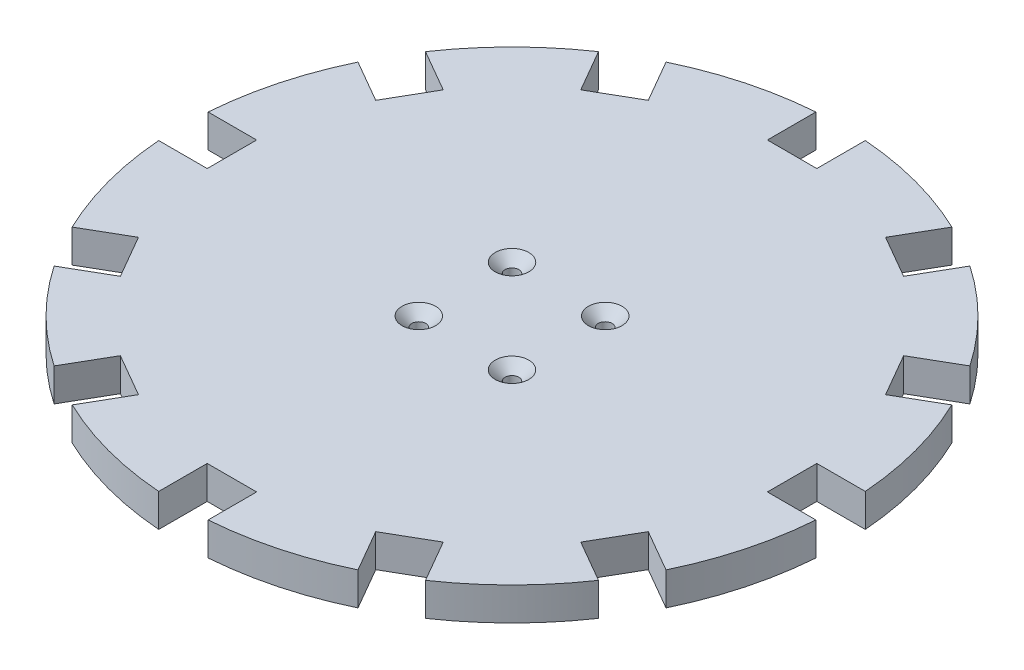
from build123d import *

# Parameters (mm, degrees)
SKIZZE1_R                       = 100
AUFSATZ_LINEAR_AUSTRAGEN1_DEPTH = 10
SKIZZE2_W                       = 15
SKIZZE2_H                       = 15
SCHNITT_LINEAR_AUSTRAGEN1_DEPTH = 142.774468788
SKIZZE3_R                       = 52.5
AUFSATZ_LINEAR_AUSTRAGEN2_DEPTH = 10
FASE1_SIZE                      = 2
SKIZZE4_R                       = 2.1
SCHNITT_LINEAR_AUSTRAGEN2_DEPTH = 143.434195332
FASE2_SIZE                      = 3


with BuildPart() as part:
    # Skizze1 → Aufsatz-Linear austragen1 (new body)
    with BuildSketch(Plane(origin=(0, 0, 0), x_dir=(1, 0, 0), z_dir=(0, 1, 0))):
        with Locations(Location((0, 0, 0), (0, 0, 270))):
            Circle(SKIZZE1_R)
    extrude(amount=AUFSATZ_LINEAR_AUSTRAGEN1_DEPTH)

    # Skizze2 → Schnitt-Linear austragen1 (cut, through all)
    with BuildSketch(Plane(origin=(0, 10, 0), x_dir=(1, 0, 0), z_dir=(0, 1, 0))):
        Polygon((77.362159322, -36.004809472), (90.352540378, -43.504809472), (82.852540378, -56.495190528), (69.862159322, -48.995190528), align=None)
        with Locations((92.5, 0)):
            Rectangle(SKIZZE2_W, SKIZZE2_H)
        Polygon((48.995190528, -69.862159322), (56.495190528, -82.852540378), (43.504809472, -90.352540378), (36.004809472, -77.362159322), align=None)
        with Locations((0, -92.5)):
            Rectangle(SKIZZE2_W, SKIZZE2_H)
        Polygon((-36.004809472, -77.362159322), (-43.504809472, -90.352540378), (-56.495190528, -82.852540378), (-48.995190528, -69.862159322), align=None)
        Polygon((-69.862159322, -48.995190528), (-82.852540378, -56.495190528), (-90.352540378, -43.504809472), (-77.362159322, -36.004809472), align=None)
        with Locations((-92.5, 0)):
            Rectangle(SKIZZE2_W, SKIZZE2_H)
        Polygon((-77.362159322, 36.004809472), (-90.352540378, 43.504809472), (-82.852540378, 56.495190528), (-69.862159322, 48.995190528), align=None)
        Polygon((-48.995190528, 69.862159322), (-56.495190528, 82.852540378), (-43.504809472, 90.352540378), (-36.004809472, 77.362159322), align=None)
        with Locations((0, 92.5)):
            Rectangle(SKIZZE2_W, SKIZZE2_H)
        Polygon((36.004809472, 77.362159322), (43.504809472, 90.352540378), (56.495190528, 82.852540378), (48.995190528, 69.862159322), align=None)
        Polygon((69.862159322, 48.995190528), (82.852540378, 56.495190528), (90.352540378, 43.504809472), (77.362159322, 36.004809472), align=None)
    extrude(amount=-SCHNITT_LINEAR_AUSTRAGEN1_DEPTH, mode=Mode.SUBTRACT)

    # Skizze3 → Aufsatz-Linear austragen2 (add)
    with BuildSketch(Plane.XZ):
        with Locations(Location((0, 0, 0), (0, 0, 90))):
            Circle(SKIZZE3_R)
    extrude(amount=AUFSATZ_LINEAR_AUSTRAGEN2_DEPTH)

    # Fase1
    fase1_edges = [part.edges().sort_by_distance(p)[0] for p in [
        (0, -10, -52.5),
    ]]
    chamfer(fase1_edges, length=FASE1_SIZE)

    # Skizze4 → Schnitt-Linear austragen2 (cut, through all)
    with BuildSketch(Plane(origin=(0, 10, 0), x_dir=(1, 0, 0), z_dir=(0, 1, 0))):
        with Locations(Location((-14.142135624, 14.142135624, 0), (0, 0, 270))):
            Circle(SKIZZE4_R)
        with Locations(Location((14.142135624, 14.142135624, 0), (0, 0, 270))):
            Circle(SKIZZE4_R)
        with Locations(Location((14.142135624, -14.142135624, 0), (0, 0, 270))):
            Circle(SKIZZE4_R)
        with Locations(Location((-14.142135624, -14.142135624, 0), (0, 0, 270))):
            Circle(SKIZZE4_R)
    extrude(amount=-SCHNITT_LINEAR_AUSTRAGEN2_DEPTH, mode=Mode.SUBTRACT)

    # Fase2
    fase2_edges = [part.edges().sort_by_distance(p)[0] for p in [
        (-14.142135624, 10, 12.042135624),
        (14.142135624, 10, 12.042135624),
        (14.142135624, 10, -16.242135624),
        (-14.142135624, 10, -16.242135624),
    ]]
    chamfer(fase2_edges, length=FASE2_SIZE)


solid = part.part
